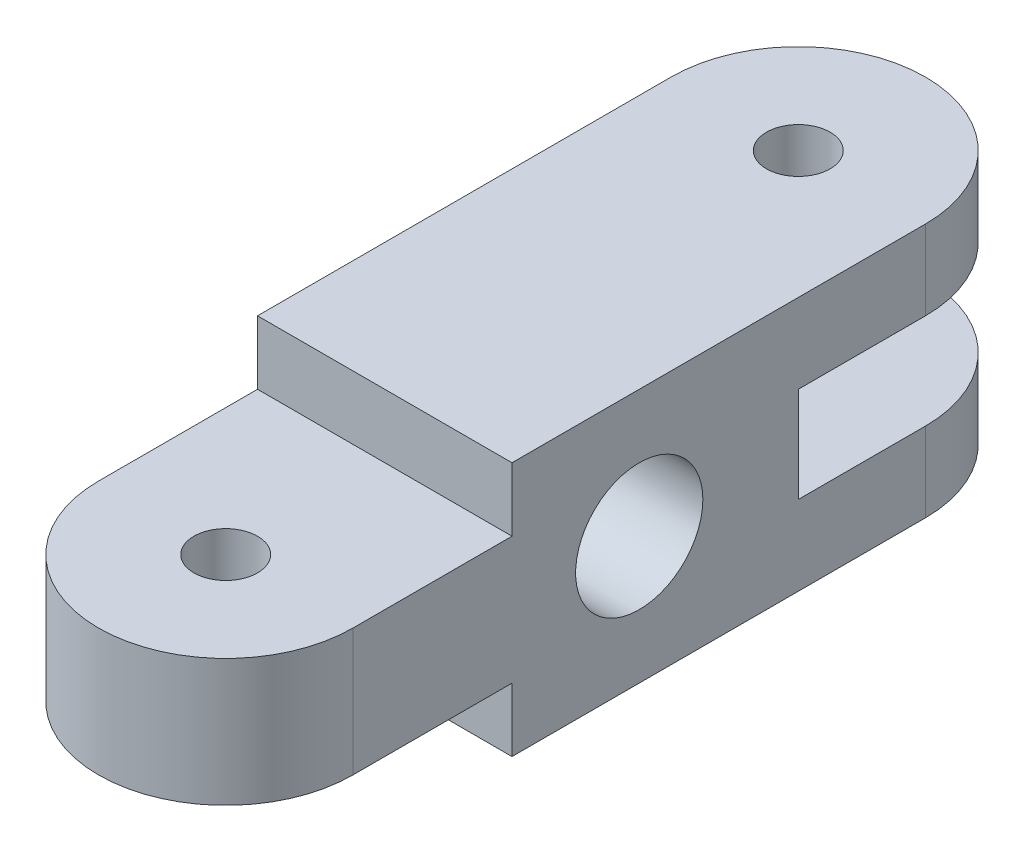
from build123d import *

# Parameters (mm, degrees)
SKETCH2_W           = 25.4
SKETCH2_H           = 25.4
BOSS_EXTRUDE1_DEPTH = 41.275
SKETCH3_R           = 6.35
SKETCH3_W           = 28.575
SKETCH3_H           = 6.35
SKETCH3_W_2         = 25.4
SKETCH3_H_2         = 9.525
CUT_EXTRUDE1_DEPTH  = 51.100654936
SKETCH4_R           = 3.175
CUT_EXTRUDE2_DEPTH  = 51.100654936


with BuildPart() as part:
    # Sketch2 → Boss-Extrude1 (new, symmetric)
    with BuildSketch(Plane.XY):
        Rectangle(SKETCH2_W, SKETCH2_H)
    extrude(amount=BOSS_EXTRUDE1_DEPTH, both=True)

    # Sketch3 → Cut-Extrude1 (cut, through all)
    with BuildSketch(Plane(origin=(12.7, 0, 0), x_dir=(0, 0, -1), z_dir=(1, 0, 0))):
        Circle(SKETCH3_R)
        with Locations((-26.9875, 9.525)):
            Rectangle(SKETCH3_W, SKETCH3_H)
        with Locations((-26.9875, -9.525)):
            Rectangle(SKETCH3_W, SKETCH3_H)
        with Locations((28.575, 0)):
            Rectangle(SKETCH3_W_2, SKETCH3_H_2)
    extrude(amount=-CUT_EXTRUDE1_DEPTH, mode=Mode.SUBTRACT)

    # Sketch4 → Cut-Extrude2 (cut, through all)
    with BuildSketch(Plane(origin=(0, 12.7, 0), x_dir=(1, 0, 0), z_dir=(0, 1, 0))):
        with Locations(Location((0, 28.575, 0), (0, 0, 270))):
            Circle(SKETCH4_R)
        with Locations(Location((0, -28.575, 0), (0, 0, 270))):
            Circle(SKETCH4_R)
        with BuildLine():
            Line((-12.7, 28.575), (-12.7, 47.625))
            Line((-12.7, 47.625), (12.7, 47.625))
            Line((12.7, 47.625), (12.7, 28.575))
            ThreePointArc((12.7, 28.575), (0, 41.275), (-12.7, 28.575))
        make_face()
        with BuildLine():
            Line((-12.7, -28.575), (-12.7, -47.625))
            Line((-12.7, -47.625), (12.7, -47.625))
            Line((12.7, -47.625), (12.7, -28.575))
            ThreePointArc((12.7, -28.575), (0, -41.275), (-12.7, -28.575))
        make_face()
    extrude(amount=-CUT_EXTRUDE2_DEPTH, mode=Mode.SUBTRACT)


solid = part.part
